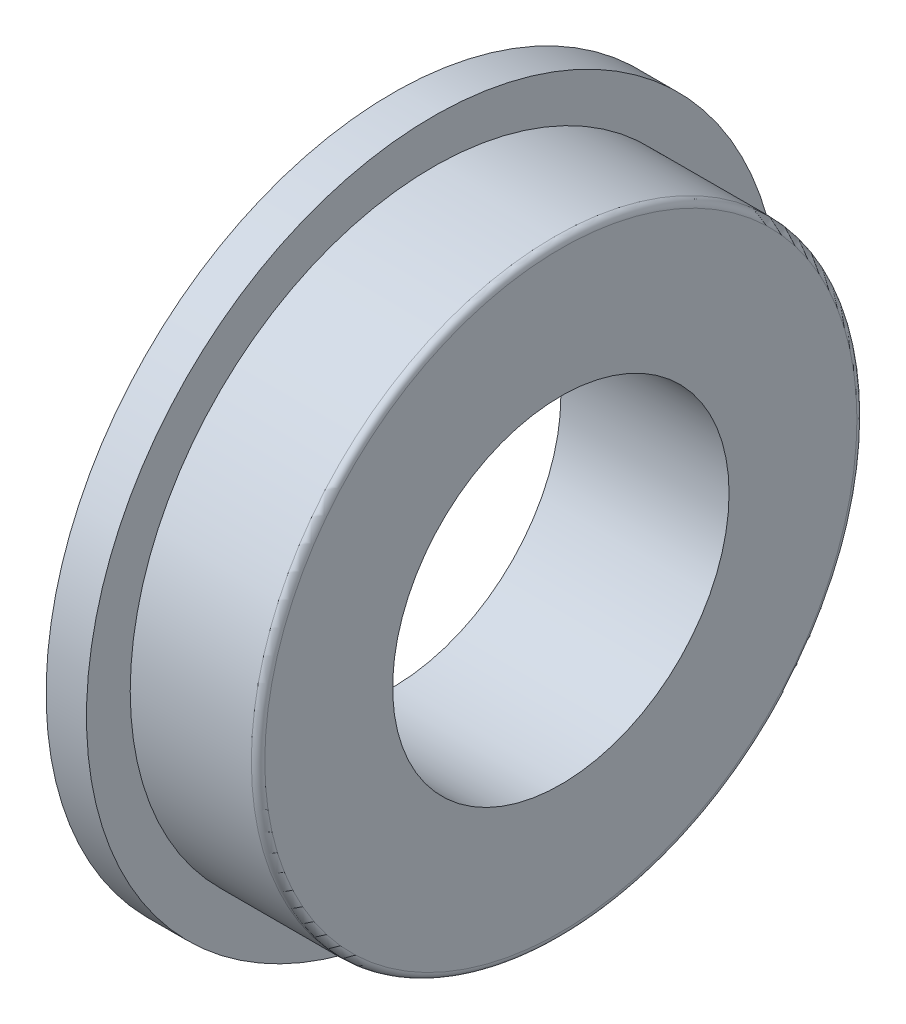
from build123d import *

# Parameters (mm, degrees)
SKETCH1_R           = 5.15
BOSS_EXTRUDE1_DEPTH = 0.6
SKETCH2_R           = 4.5
BOSS_EXTRUDE2_DEPTH = 1.9
SKETCH3_R           = 2.5
CUT_EXTRUDE1_DEPTH  = 8.700324668
FILLET1_R           = 0.1


with BuildPart() as part:
    # Sketch1 → Boss-Extrude1 (new body)
    with BuildSketch(Plane(origin=(0, 0, 0), x_dir=(0, 0, -1), z_dir=(1, 0, 0))):
        Circle(SKETCH1_R)
    extrude(amount=BOSS_EXTRUDE1_DEPTH)

    # Sketch2 → Boss-Extrude2 (add)
    with BuildSketch(Plane(origin=(0.6, 0, 0), x_dir=(0, 0, -1), z_dir=(1, 0, 0))):
        with Locations(Location((0, 0, 0), (0, 0, 180))):
            Circle(SKETCH2_R)
    extrude(amount=BOSS_EXTRUDE2_DEPTH)

    # Sketch3 → Cut-Extrude1 (cut, through all)
    with BuildSketch(Plane(origin=(2.5, 0, 0), x_dir=(0, 0, -1), z_dir=(1, 0, 0))):
        Circle(SKETCH3_R)
    extrude(amount=-CUT_EXTRUDE1_DEPTH, mode=Mode.SUBTRACT)

    # Fillet1
    fillet1_edges = [part.edges().sort_by_distance(p)[0] for p in [
        (2.5, 0, -4.5),
    ]]
    fillet(fillet1_edges, radius=FILLET1_R)


solid = part.part
